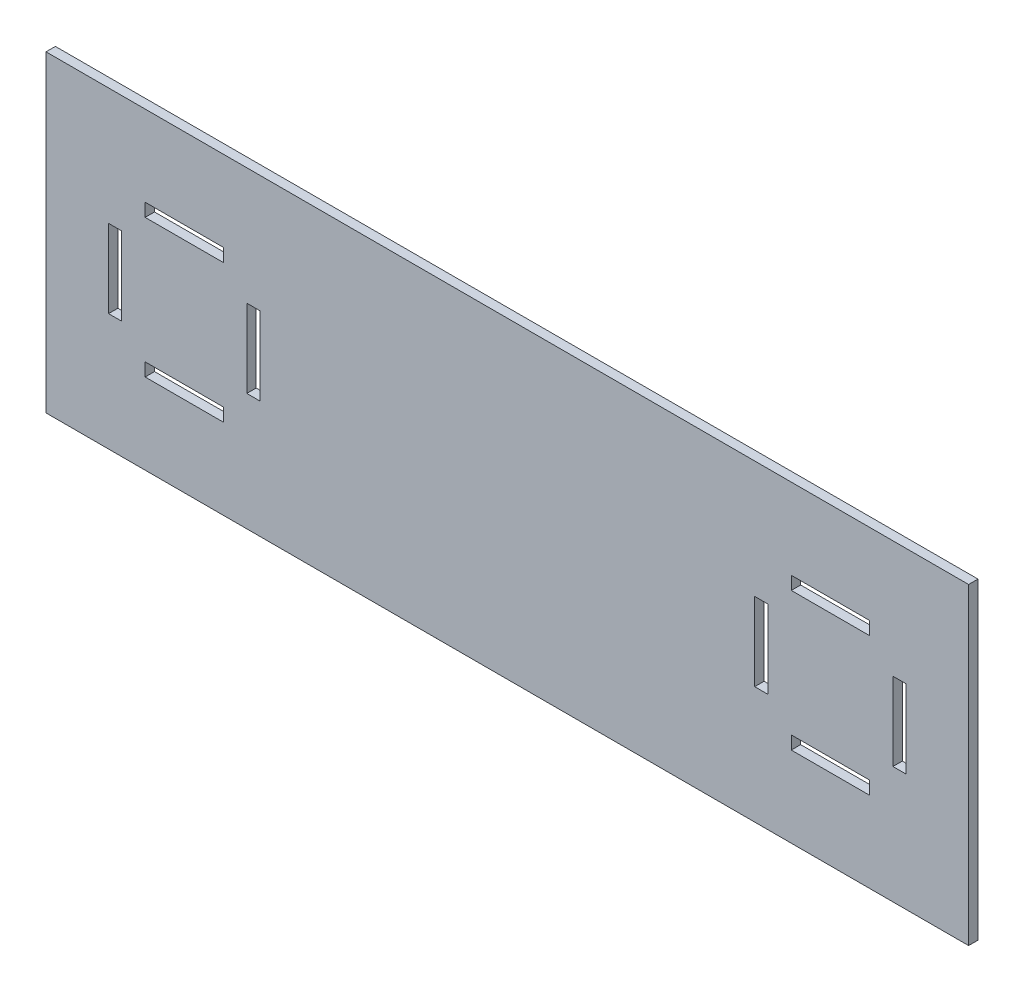
from build123d import *

# Parameters (mm, degrees)
ESBO_O1_W                = 295
ESBO_O1_H                = 100
RESSALTO_EXTRUS_O1_DEPTH = 3
ESBO_O2_W                = 4.2
ESBO_O2_H                = 25
ESBO_O2_W_2              = 25
ESBO_O2_H_2              = 4.2
CORTE_EXTRUS_O1_DEPTH    = 156.773072127


with BuildPart() as part:
    # Esboço1 → Ressalto-extrusão1 (new body)
    with BuildSketch(Plane.XY):
        Rectangle(ESBO_O1_W, ESBO_O1_H)
    extrude(amount=RESSALTO_EXTRUS_O1_DEPTH)

    # Esboço2 → Corte-extrusão1 (cut, through all)
    with BuildSketch(Plane.XY.offset(3)):
        with Locations((125.4, 0)):
            Rectangle(ESBO_O2_W, ESBO_O2_H)
        with Locations((-81.2, 0)):
            Rectangle(ESBO_O2_W, ESBO_O2_H)
        with Locations((-125.4, 0)):
            Rectangle(ESBO_O2_W, ESBO_O2_H)
        with Locations((-103.3, 22.1)):
            Rectangle(ESBO_O2_W_2, ESBO_O2_H_2)
        with Locations((-103.3, -22.1)):
            Rectangle(ESBO_O2_W_2, ESBO_O2_H_2)
        with Locations((81.2, 0)):
            Rectangle(ESBO_O2_W, ESBO_O2_H)
        with Locations((103.3, -22.1)):
            Rectangle(ESBO_O2_W_2, ESBO_O2_H_2)
        with Locations((103.3, 22.1)):
            Rectangle(ESBO_O2_W_2, ESBO_O2_H_2)
    extrude(amount=-CORTE_EXTRUS_O1_DEPTH, mode=Mode.SUBTRACT)


solid = part.part
